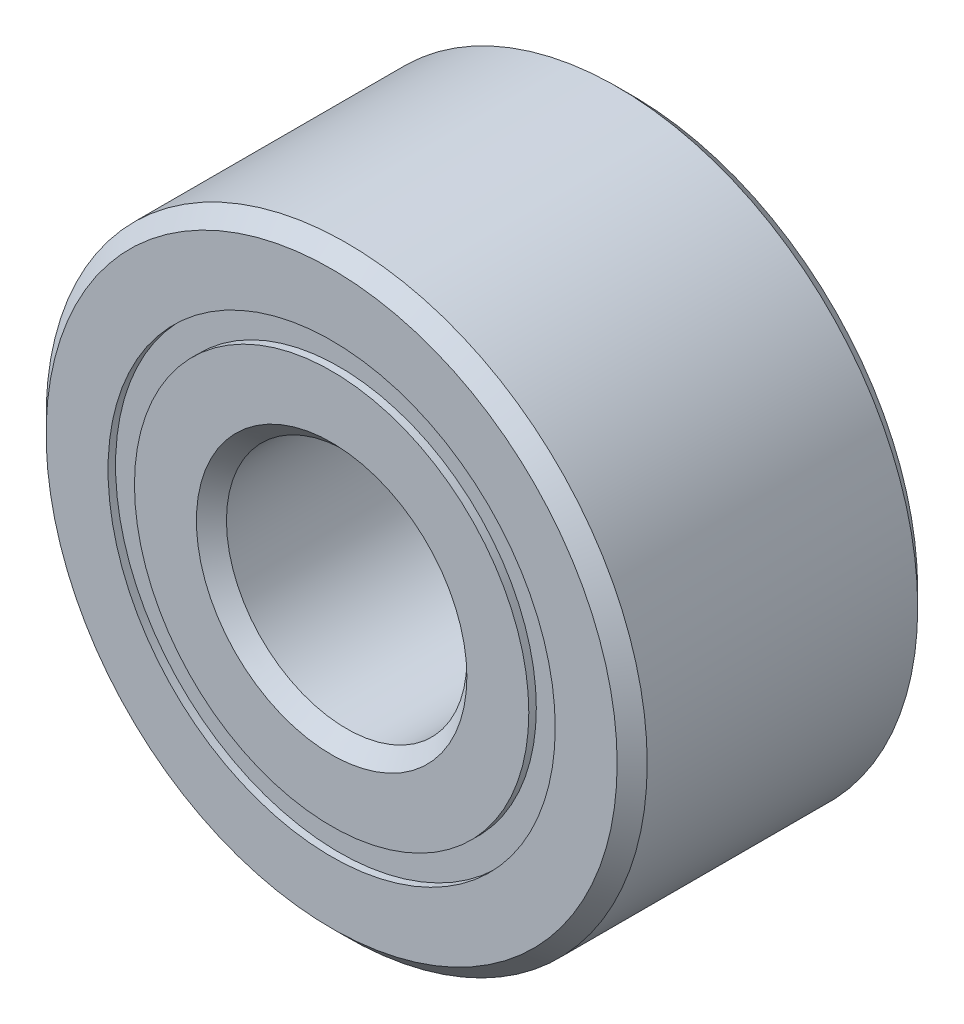
from build123d import *

# Parameters (mm, degrees)
CIRPATTERN1_COUNT = 8
SKETCH5_W         = 0.621180469
SKETCH5_H         = 0.21978022


with BuildPart() as part:
    # Sketch1 → Revolve1 (revolve)
    with BuildSketch(Plane(origin=(0, 0, 0), x_dir=(0, 0, -1), z_dir=(1, 0, 0))):
        with BuildLine():
            Line((1.125, 2.5), (-1.125, 2.5))
            Line((-1.125, 2.5), (-1.25, 2.375))
            Line((-1.25, 2.375), (-1.25, 1.85989011))
            Line((-1.25, 1.85989011), (-0.555555556, 1.85989011))
            ThreePointArc((-0.555555556, 1.85989011), (0, 2.316319531), (0.555555556, 1.85989011))
            Line((0.555555556, 1.85989011), (1.25, 1.85989011))
            Line((1.25, 1.85989011), (1.25, 2.375))
            Line((1.25, 2.375), (1.125, 2.5))
        make_face()
    revolve(axis=Axis((0, 0, 1.25), (0, 0, -1)))


with BuildPart() as body_2:
    # Sketch3 → Revolve3 (revolve)
    with BuildSketch(Plane(origin=(0, 0, 0), x_dir=(0, 0, -1), z_dir=(1, 0, 0))):
        with BuildLine():
            Line((-1.25, 1.64010989), (-0.555555556, 1.64010989))
            ThreePointArc((-0.555555556, 1.64010989), (0, 1.183680469), (0.555555556, 1.64010989))
            Line((0.555555556, 1.64010989), (1.25, 1.64010989))
            Line((1.25, 1.64010989), (1.25, 1.125))
            Line((1.25, 1.125), (1.125, 1))
            Line((1.125, 1), (-1.125, 1))
            Line((-1.125, 1), (-1.25, 1.125))
            Line((-1.25, 1.125), (-1.25, 1.64010989))
        make_face()
    revolve(axis=Axis((0, 0, 1.25), (0, 0, -1)))


with BuildPart() as body_3:
    # Sketch4 → Revolve4 (revolve)
    with BuildSketch(Plane(origin=(0, 0, 0), x_dir=(0, 0, -1), z_dir=(1, 0, 0))):
        with BuildLine():
            Line((-0.566319531, 1.75), (0.566319531, 1.75))
            ThreePointArc((0.566319531, 1.75), (0, 2.316319531), (-0.566319531, 1.75))
        make_face()
    revolve(axis=Axis((0, 1.75, 0.566319531), (0, 0, -1)))


with BuildPart() as cirpattern1_1:
    # CirPattern1: pattern copy
    add(body_3.part.rotate(Axis((0, 0, -1.25), (0, 0, 1)), 1 * 360 / CIRPATTERN1_COUNT))


with BuildPart() as cirpattern1_2:
    # CirPattern1: pattern copy
    add(body_3.part.rotate(Axis((0, 0, -1.25), (0, 0, 1)), 2 * 360 / CIRPATTERN1_COUNT))


with BuildPart() as cirpattern1_3:
    # CirPattern1: pattern copy
    add(body_3.part.rotate(Axis((0, 0, -1.25), (0, 0, 1)), 3 * 360 / CIRPATTERN1_COUNT))


with BuildPart() as cirpattern1_4:
    # CirPattern1: pattern copy
    add(body_3.part.rotate(Axis((0, 0, -1.25), (0, 0, 1)), 4 * 360 / CIRPATTERN1_COUNT))


with BuildPart() as cirpattern1_5:
    # CirPattern1: pattern copy
    add(body_3.part.rotate(Axis((0, 0, -1.25), (0, 0, 1)), 5 * 360 / CIRPATTERN1_COUNT))


with BuildPart() as cirpattern1_6:
    # CirPattern1: pattern copy
    add(body_3.part.rotate(Axis((0, 0, -1.25), (0, 0, 1)), 6 * 360 / CIRPATTERN1_COUNT))


with BuildPart() as cirpattern1_7:
    # CirPattern1: pattern copy
    add(body_3.part.rotate(Axis((0, 0, -1.25), (0, 0, 1)), 7 * 360 / CIRPATTERN1_COUNT))


with BuildPart() as body_11:
    # Sketch5 → Revolve5 (revolve)
    with BuildSketch(Plane(origin=(0, 0, 0), x_dir=(0, 0, -1), z_dir=(1, 0, 0))):
        with Locations((-0.876909765, 1.75)):
            Rectangle(SKETCH5_W, SKETCH5_H)
        with Locations((0.876909765, 1.75)):
            Rectangle(SKETCH5_W, SKETCH5_H)
    revolve(axis=Axis((0, 0, 1.25), (0, 0, -1)))


solid = Compound([part.part, body_2.part, body_3.part, cirpattern1_1.part, cirpattern1_2.part, cirpattern1_3.part, cirpattern1_4.part, cirpattern1_5.part, cirpattern1_6.part, cirpattern1_7.part, body_11.part])
